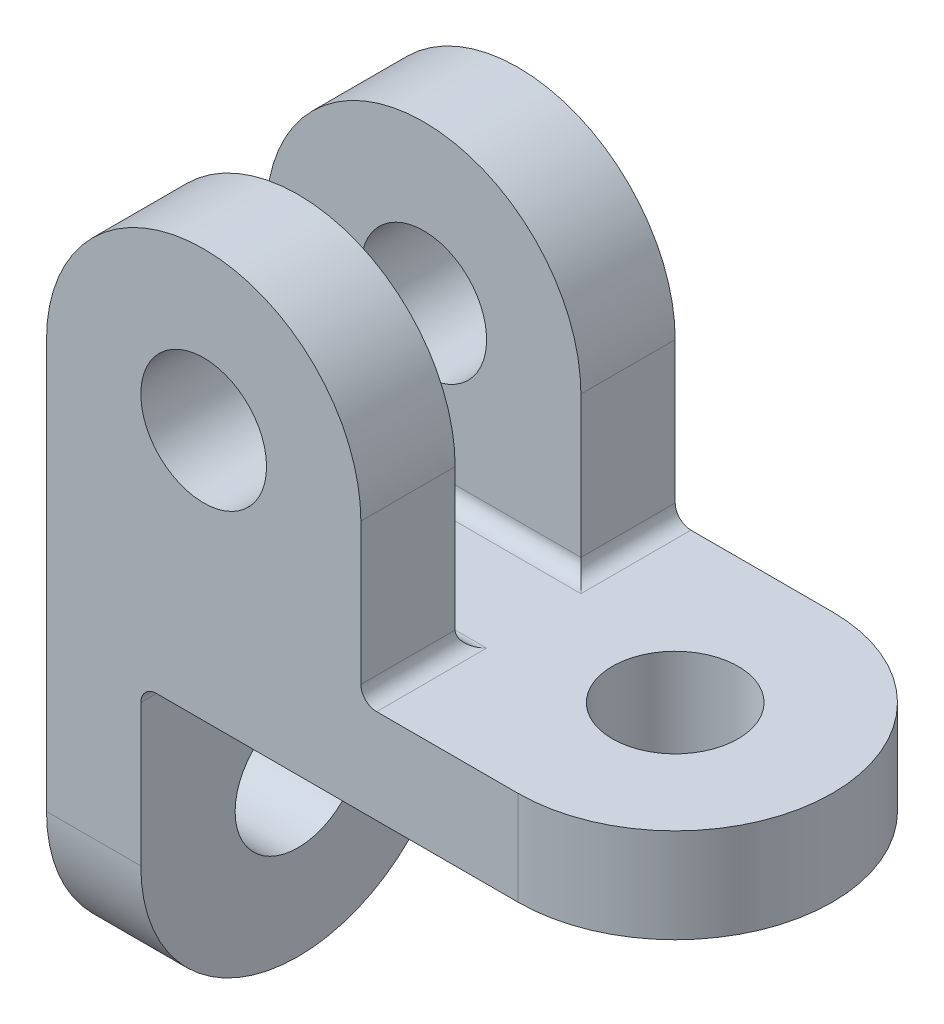
from build123d import *

# Parameters (mm, degrees)
BOSS_EXTRUDE1_DEPTH = 12
SKETCH2_R           = 8
CUT_EXTRUDE1_DEPTH  = 56.172456897
SKETCH3_R           = 8
BOSS_EXTRUDE2_DEPTH = 12
BOSS_EXTRUDE3_START = -12
SKETCH4_R           = 8
BOSS_EXTRUDE3_DEPTH = 12
SKETCH5_R           = 8
BOSS_EXTRUDE4_DEPTH = 12
FILLET1_R           = 2


with BuildPart() as part:
    # Sketch1 → Boss-Extrude1 (new body)
    with BuildSketch(Plane(origin=(0, 0, 0), x_dir=(1, 0, 0), z_dir=(0, 1, 0))):
        with BuildLine():
            Line((-30, 20), (-30, -20))
            Line((-30, -20), (30, -20))
            ThreePointArc((30, -20), (50, 0), (30, 20))
            Line((30, 20), (-30, 20))
        make_face()
    extrude(amount=BOSS_EXTRUDE1_DEPTH)

    # Sketch2 → Cut-Extrude1 (cut, through all)
    with BuildSketch(Plane(origin=(0, 12, 0), x_dir=(1, 0, 0), z_dir=(0, 1, 0))):
        with Locations(Location((30, 0, 0), (0, 0, 270))):
            Circle(SKETCH2_R)
    extrude(amount=-CUT_EXTRUDE1_DEPTH, mode=Mode.SUBTRACT)

    # Sketch3 → Boss-Extrude2 (add)
    with BuildSketch(Plane.XY.offset(20)):
        with BuildLine():
            Line((-30, 32), (-30, 12))
            Line((-30, 12), (10, 12))
            Line((10, 12), (10, 32))
            ThreePointArc((10, 32), (-10, 52), (-30, 32))
        make_face()
        with Locations((-10, 32)):
            Circle(SKETCH3_R, mode=Mode.SUBTRACT)
    extrude(amount=-BOSS_EXTRUDE2_DEPTH)

    # Sketch4 → Boss-Extrude3 (add)
    with BuildSketch(Plane(origin=(0, 0, -20), x_dir=(-1, 0, 0), z_dir=(0, 0, -1)).offset(BOSS_EXTRUDE3_START)):
        with BuildLine():
            Line((-10, 32), (-10, 12))
            Line((-10, 12), (30, 12))
            Line((30, 12), (30, 32))
            ThreePointArc((30, 32), (10, 52), (-10, 32))
        make_face()
        with Locations(Location((10, 32, 0), (0, 0, 180))):
            Circle(SKETCH4_R, mode=Mode.SUBTRACT)
    extrude(amount=BOSS_EXTRUDE3_DEPTH)

    # Sketch5 → Boss-Extrude4 (add)
    with BuildSketch(Plane.ZY.offset(30)):
        with BuildLine():
            Line((-20, -20), (-20, 0))
            Line((-20, 0), (20, 0))
            Line((20, 0), (20, -20))
            ThreePointArc((20, -20), (0, -40), (-20, -20))
        make_face()
        with Locations((0, -20)):
            Circle(SKETCH5_R, mode=Mode.SUBTRACT)
    extrude(amount=-BOSS_EXTRUDE4_DEPTH)

    # Fillet1
    fillet1_edges = [part.edges().sort_by_distance(p)[0] for p in [
        (-10, 12, 8),
        (10, 12, 14),
        (-10, 12, -8),
        (10, 12, -14),
        (-18, 0, 0),
    ]]
    fillet(fillet1_edges, radius=FILLET1_R)


solid = part.part
